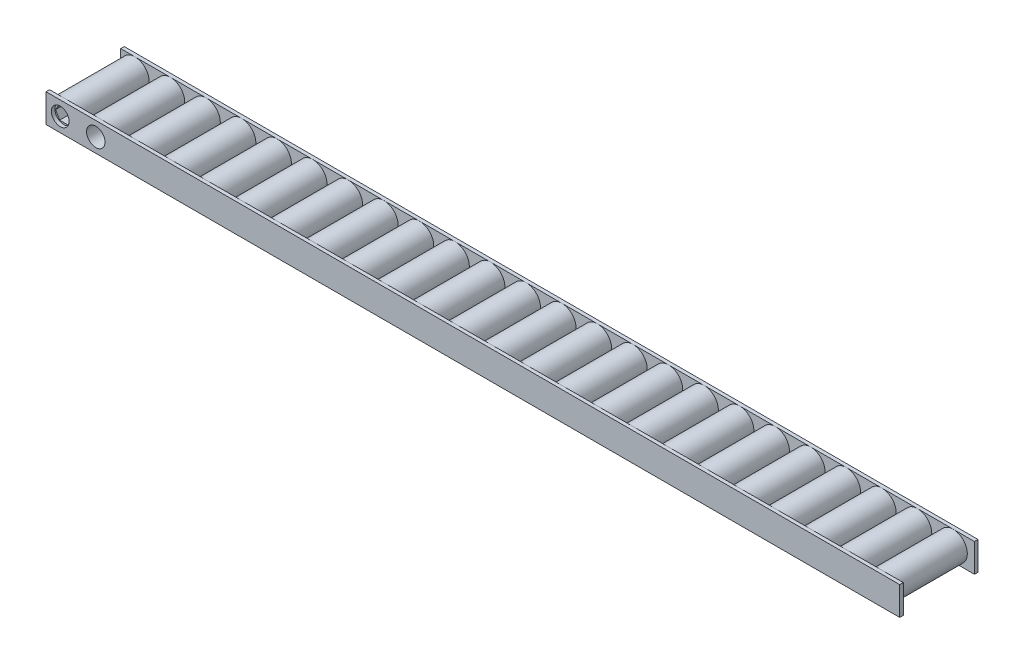
from build123d import *

# Parameters (mm, degrees)
SKETCH1_R           = 12.7
BOSS_EXTRUDE1_DEPTH = 63.5
LPATTERN1_COUNT     = 24
LPATTERN1_PITCH     = 31.75
SKETCH2_W           = 762
SKETCH2_H           = 25.4
BOSS_EXTRUDE2_DEPTH = 3.175
SKETCH3_R           = 8.255
CUT_EXTRUDE1_DEPTH  = 753.655832702
SKETCH6_R           = 7.9375
CUT_EXTRUDE2_DEPTH  = 3.175


with BuildPart() as part:
    # Sketch1 → Boss-Extrude1 (new body)
    with BuildSketch(Plane.XY):
        Circle(SKETCH1_R)
    extrude(amount=BOSS_EXTRUDE1_DEPTH)


with BuildPart() as lpattern1_1:
    # LPattern1: pattern copy
    add(part.part.moved(Location(Vector(1, 0, 0) * (1 * LPATTERN1_PITCH))))


with BuildPart() as lpattern1_2:
    # LPattern1: pattern copy
    add(part.part.moved(Location(Vector(1, 0, 0) * (2 * LPATTERN1_PITCH))))


with BuildPart() as lpattern1_3:
    # LPattern1: pattern copy
    add(part.part.moved(Location(Vector(1, 0, 0) * (3 * LPATTERN1_PITCH))))


with BuildPart() as lpattern1_4:
    # LPattern1: pattern copy
    add(part.part.moved(Location(Vector(1, 0, 0) * (4 * LPATTERN1_PITCH))))


with BuildPart() as lpattern1_5:
    # LPattern1: pattern copy
    add(part.part.moved(Location(Vector(1, 0, 0) * (5 * LPATTERN1_PITCH))))


with BuildPart() as lpattern1_6:
    # LPattern1: pattern copy
    add(part.part.moved(Location(Vector(1, 0, 0) * (6 * LPATTERN1_PITCH))))


with BuildPart() as lpattern1_7:
    # LPattern1: pattern copy
    add(part.part.moved(Location(Vector(1, 0, 0) * (7 * LPATTERN1_PITCH))))


with BuildPart() as lpattern1_8:
    # LPattern1: pattern copy
    add(part.part.moved(Location(Vector(1, 0, 0) * (8 * LPATTERN1_PITCH))))


with BuildPart() as lpattern1_9:
    # LPattern1: pattern copy
    add(part.part.moved(Location(Vector(1, 0, 0) * (9 * LPATTERN1_PITCH))))


with BuildPart() as lpattern1_10:
    # LPattern1: pattern copy
    add(part.part.moved(Location(Vector(1, 0, 0) * (10 * LPATTERN1_PITCH))))


with BuildPart() as lpattern1_11:
    # LPattern1: pattern copy
    add(part.part.moved(Location(Vector(1, 0, 0) * (11 * LPATTERN1_PITCH))))


with BuildPart() as lpattern1_12:
    # LPattern1: pattern copy
    add(part.part.moved(Location(Vector(1, 0, 0) * (12 * LPATTERN1_PITCH))))


with BuildPart() as lpattern1_13:
    # LPattern1: pattern copy
    add(part.part.moved(Location(Vector(1, 0, 0) * (13 * LPATTERN1_PITCH))))


with BuildPart() as lpattern1_14:
    # LPattern1: pattern copy
    add(part.part.moved(Location(Vector(1, 0, 0) * (14 * LPATTERN1_PITCH))))


with BuildPart() as lpattern1_15:
    # LPattern1: pattern copy
    add(part.part.moved(Location(Vector(1, 0, 0) * (15 * LPATTERN1_PITCH))))


with BuildPart() as lpattern1_16:
    # LPattern1: pattern copy
    add(part.part.moved(Location(Vector(1, 0, 0) * (16 * LPATTERN1_PITCH))))


with BuildPart() as lpattern1_17:
    # LPattern1: pattern copy
    add(part.part.moved(Location(Vector(1, 0, 0) * (17 * LPATTERN1_PITCH))))


with BuildPart() as lpattern1_18:
    # LPattern1: pattern copy
    add(part.part.moved(Location(Vector(1, 0, 0) * (18 * LPATTERN1_PITCH))))


with BuildPart() as lpattern1_19:
    # LPattern1: pattern copy
    add(part.part.moved(Location(Vector(1, 0, 0) * (19 * LPATTERN1_PITCH))))


with BuildPart() as lpattern1_20:
    # LPattern1: pattern copy
    add(part.part.moved(Location(Vector(1, 0, 0) * (20 * LPATTERN1_PITCH))))


with BuildPart() as lpattern1_21:
    # LPattern1: pattern copy
    add(part.part.moved(Location(Vector(1, 0, 0) * (21 * LPATTERN1_PITCH))))


with BuildPart() as lpattern1_22:
    # LPattern1: pattern copy
    add(part.part.moved(Location(Vector(1, 0, 0) * (22 * LPATTERN1_PITCH))))


with BuildPart() as lpattern1_23:
    # LPattern1: pattern copy
    add(part.part.moved(Location(Vector(1, 0, 0) * (23 * LPATTERN1_PITCH))))


with BuildPart() as part_1:
    add(part.part)

    add(lpattern1_1.part)  # Boss-Extrude2 merges LPattern1_1

    add(lpattern1_2.part)  # Boss-Extrude2 merges LPattern1_2

    add(lpattern1_3.part)  # Boss-Extrude2 merges LPattern1_3

    add(lpattern1_4.part)  # Boss-Extrude2 merges LPattern1_4

    add(lpattern1_5.part)  # Boss-Extrude2 merges LPattern1_5

    add(lpattern1_6.part)  # Boss-Extrude2 merges LPattern1_6

    add(lpattern1_7.part)  # Boss-Extrude2 merges LPattern1_7

    add(lpattern1_8.part)  # Boss-Extrude2 merges LPattern1_8

    add(lpattern1_9.part)  # Boss-Extrude2 merges LPattern1_9

    add(lpattern1_10.part)  # Boss-Extrude2 merges LPattern1_10

    add(lpattern1_11.part)  # Boss-Extrude2 merges LPattern1_11

    add(lpattern1_12.part)  # Boss-Extrude2 merges LPattern1_12

    add(lpattern1_13.part)  # Boss-Extrude2 merges LPattern1_13

    add(lpattern1_14.part)  # Boss-Extrude2 merges LPattern1_14
    # Sketch2 → Boss-Extrude2 (add)
    with BuildSketch(Plane.XY.offset(63.5)):
        with Locations((368.3, 0)):
            Rectangle(SKETCH2_W, SKETCH2_H)
    boss_extrude2 = extrude(amount=BOSS_EXTRUDE2_DEPTH)

    # Mirror1: Boss-Extrude2 across plane
    add(boss_extrude2.mirror(Plane.XY.offset(31.75)))

    # Sketch3 → Cut-Extrude1 (cut, through all)
    with BuildSketch(Plane.XY.offset(66.675)):
        with Locations((31.75, 0)):
            Circle(SKETCH3_R)
        Polygon((7.332348419, 0), (3.666174209, 6.35), (-3.666174209, 6.35), (-7.332348419, 0), (-3.666174209, -6.35), (3.666174209, -6.35), align=None)
    extrude(amount=-CUT_EXTRUDE1_DEPTH, mode=Mode.SUBTRACT)

    # Sketch6 → Cut-Extrude2 (cut)
    with BuildSketch(Plane.XY.offset(66.675)):
        Circle(SKETCH6_R)
    cut_extrude2 = extrude(amount=-CUT_EXTRUDE2_DEPTH, mode=Mode.SUBTRACT)

    # Mirror2: Cut-Extrude2 across plane
    add(cut_extrude2.mirror(Plane.XY.offset(31.75)), mode=Mode.SUBTRACT)


solid = Compound([lpattern1_15.part, lpattern1_16.part, lpattern1_17.part, lpattern1_18.part, lpattern1_19.part, lpattern1_20.part, lpattern1_21.part, lpattern1_22.part, lpattern1_23.part, part_1.part])
